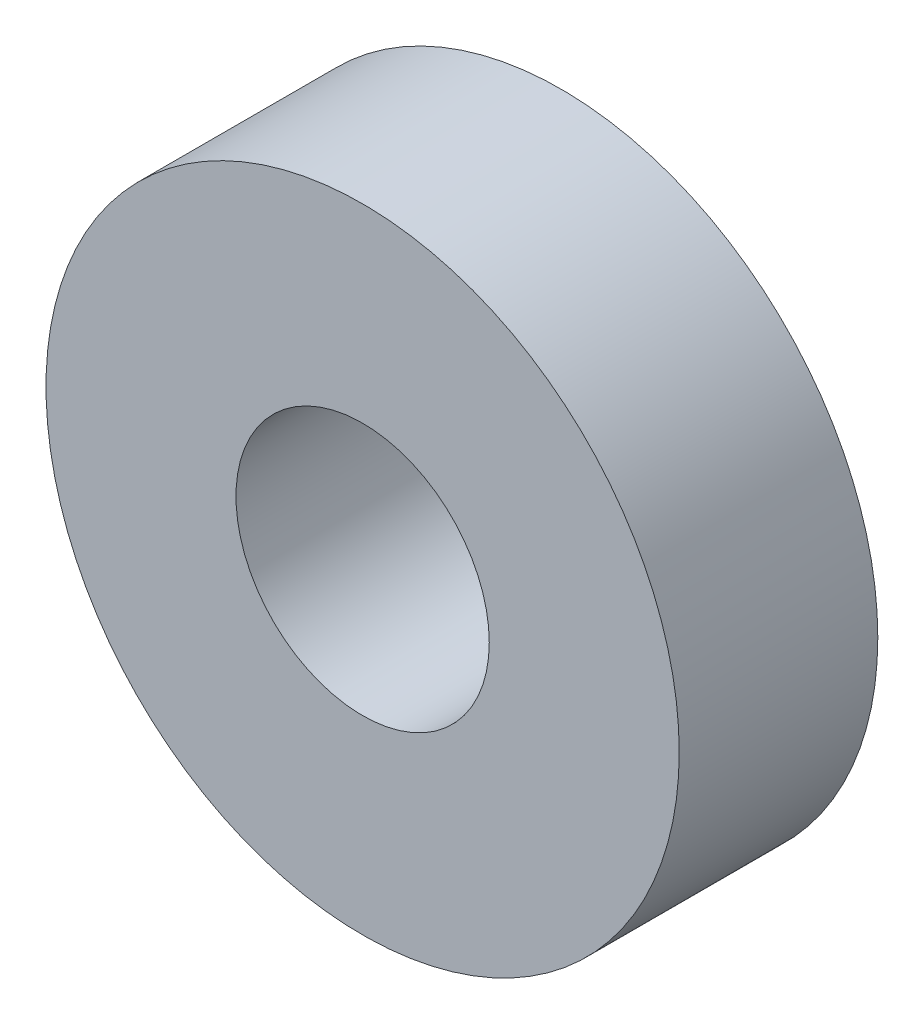
from build123d import *

# Parameters (mm, degrees)
SKETCH1_R           = 7.9375
SKETCH1_R_2         = 3.175
BOSS_EXTRUDE1_DEPTH = 4.9784


with BuildPart() as part:
    # Sketch1 → Boss-Extrude1 (new body)
    with BuildSketch(Plane.XY):
        Circle(SKETCH1_R)
        Circle(SKETCH1_R_2, mode=Mode.SUBTRACT)
    extrude(amount=BOSS_EXTRUDE1_DEPTH)


solid = part.part
